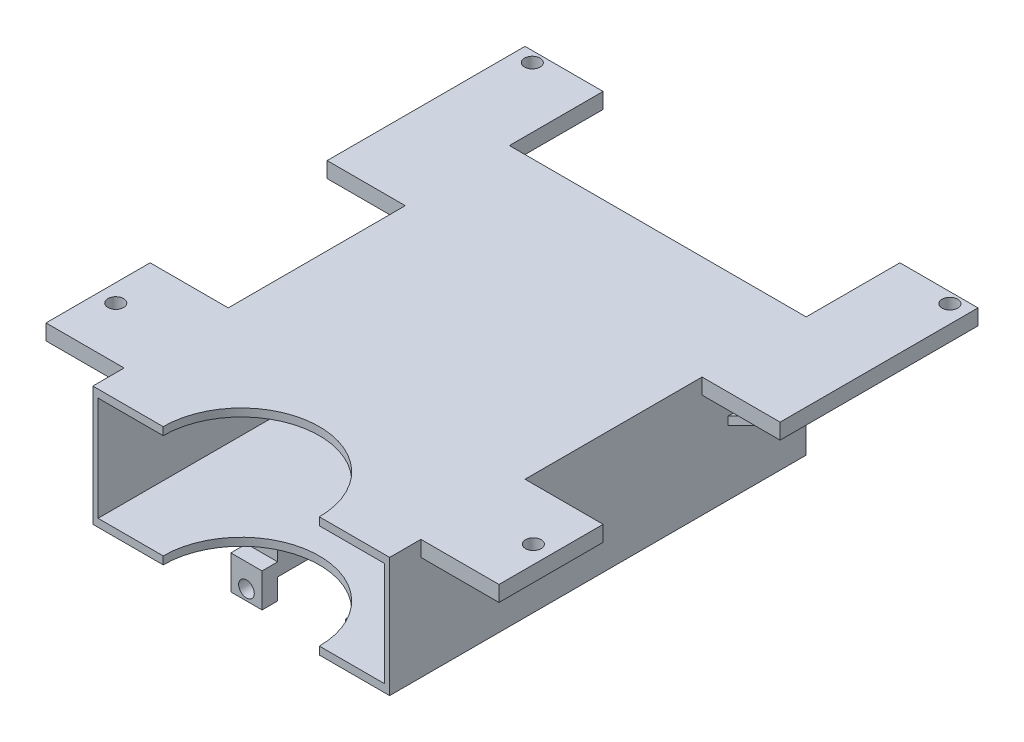
from build123d import *

# Parameters (mm, degrees)
SKETCH_1_W               = 57
SKETCH_1_H               = 23
EXTRUDE_1_DEPTH          = 80
SKETCH_2_W               = 55
SKETCH_2_H               = 20
CUT_EXTRUDE_1_DEPTH      = 75
SKETCH_3_W               = 6
SKETCH_3_H               = 6
EXTRUDE_2_DEPTH          = 6
SKETCH_4_W               = 6
SKETCH_4_H               = 6.5
SKETCH_4_R               = 1.5
EXTRUDE_3_DEPTH          = 3
MIRROR_2_COPY_1_SKETCH_W = 6
MIRROR_2_COPY_1_SKETCH_H = 6.5
MIRROR_2_COPY_1_SKETCH_R = 1.5
MIRROR_2_COPY_1_DEPTH    = 3
CUT_EXTRUDE_3_DEPTH      = 104.624321469
CUT_EXTRUDE_3_DEPTH_BACK = 25
SKETCH_6_W               = 38
SKETCH_6_H               = 3
SKETCH_6_W_2             = 20
EXTRUDE_4_DEPTH          = 15
SKETCH_8_R               = 1.5
CUT_EXTRUDE_4_DEPTH      = 113.57441983
EXTRUDE_5_DEPTH          = 5


with BuildPart() as part:
    # 草图1 → 凸台-拉伸1 (new body)
    with BuildSketch(Plane.XY):
        with Locations((28.5, 11.5)):
            Rectangle(SKETCH_1_W, SKETCH_1_H)
    extrude(amount=EXTRUDE_1_DEPTH)

    # 草图2 → 切除-拉伸1 (cut)
    with BuildSketch(Plane.XY.offset(80)):
        with Locations((28.5, 11.5)):
            Rectangle(SKETCH_2_W, SKETCH_2_H)
    extrude(amount=-CUT_EXTRUDE_1_DEPTH, mode=Mode.SUBTRACT)

    # 草图3 → 凸台-拉伸2 (add)
    with BuildSketch(Plane.XZ):
        with Locations((17.5, 62)):
            Rectangle(SKETCH_3_W, SKETCH_3_H)
        with Locations((17.5, 7)):
            Rectangle(SKETCH_3_W, SKETCH_3_H)
        with Locations((39.5, 7)):
            Rectangle(SKETCH_3_W, SKETCH_3_H)
        with Locations((39.5, 62)):
            Rectangle(SKETCH_3_W, SKETCH_3_H)
    extrude(amount=EXTRUDE_2_DEPTH)

    # 草图4 → 凸台-拉伸3 (add)
    with BuildSketch(Plane.XY.offset(65)):
        with Locations((39.5, -6.75)):
            Rectangle(SKETCH_4_W, SKETCH_4_H)
        with Locations((39.5, -8)):
            Circle(SKETCH_4_R, mode=Mode.SUBTRACT)
    extrude_3 = extrude(amount=EXTRUDE_3_DEPTH)

    # 镜向1: 凸台-拉伸3 across plane
    add(extrude_3.mirror(Plane.XY.offset(34.5)))

    # 镜向2: 凸台-拉伸3 across plane
    add(extrude_3.mirror(Plane.ZY.offset(-28.5)))

    # 镜向2 copy 1 sketch → 镜向2 copy 1 (add)
    with BuildSketch(Plane(origin=(57, 0, 4), x_dir=(-1, 0, 0), z_dir=(0, 0, -1))):
        with Locations((39.5, -6.75)):
            Rectangle(MIRROR_2_COPY_1_SKETCH_W, MIRROR_2_COPY_1_SKETCH_H)
        with Locations((39.5, -8)):
            Circle(MIRROR_2_COPY_1_SKETCH_R, mode=Mode.SUBTRACT)
    extrude(amount=MIRROR_2_COPY_1_DEPTH)

    # 草图5 → 切除-拉伸3 (cut, two sides: drawn at the far end of the back side and taken through both)
    with BuildSketch(Plane(origin=(0, 23, 0), x_dir=(1, 0, 0), z_dir=(0, 1, 0)).offset(-CUT_EXTRUDE_3_DEPTH_BACK)):
        with BuildLine():
            Line((43.5, -272.123584415), (43.5, -80))
            ThreePointArc((43.5, -80), (28.5, -65), (13.5, -80))
            Line((13.5, -80), (13.5, -272.123584415))
            Line((13.5, -272.123584415), (13.5, -656.370753244))
            Line((13.5, -656.370753244), (43.5, -656.370753244))
            Line((43.5, -656.370753244), (43.5, -272.123584415))
        make_face()
    extrude(amount=CUT_EXTRUDE_3_DEPTH + CUT_EXTRUDE_3_DEPTH_BACK, mode=Mode.SUBTRACT)

    # 草图6 → 凸台-拉伸4 (add)
    with BuildSketch(Plane.ZY):
        with Locations((1, 21.5)):
            Rectangle(SKETCH_6_W, SKETCH_6_H)
        with Locations((64, 21.5)):
            Rectangle(SKETCH_6_W_2, SKETCH_6_H)
    extrude_4 = extrude(amount=EXTRUDE_4_DEPTH)

    # 镜向3: 凸台-拉伸4 across plane
    add(extrude_4.mirror(Plane.ZY.offset(-28.5)))

    # 草图8 → 切除-拉伸4 (cut, through all)
    with BuildSketch(Plane(origin=(0, 23, 0), x_dir=(1, 0, 0), z_dir=(0, 1, 0))):
        with Locations(Location((-11.6, 16, 0), (0, 0, 270))):
            Circle(SKETCH_8_R)
        with Locations(Location((68.6, 16, 0), (0, 0, 90))):
            Circle(SKETCH_8_R)
        with Locations(Location((-11.6, -64, 0), (0, 0, 270))):
            Circle(SKETCH_8_R)
        with Locations(Location((68.6, -64, 0), (0, 0, 270))):
            Circle(SKETCH_8_R)
    extrude(amount=-CUT_EXTRUDE_4_DEPTH, mode=Mode.SUBTRACT)

    # 草图12 → 凸台-拉伸5 (add, symmetric)
    with BuildSketch(Plane(origin=(0, 0, 10), x_dir=(-1, 0, 0), z_dir=(0, 0, -1))):
        Polygon((15, 20), (0, 12.4), (0, 14), (11.842105263, 20), align=None)
    extrude_5 = extrude(amount=EXTRUDE_5_DEPTH, both=True)

    # 镜向4: 凸台-拉伸5 across plane
    add(extrude_5.mirror(Plane.ZY.offset(-28.5)))


solid = part.part
